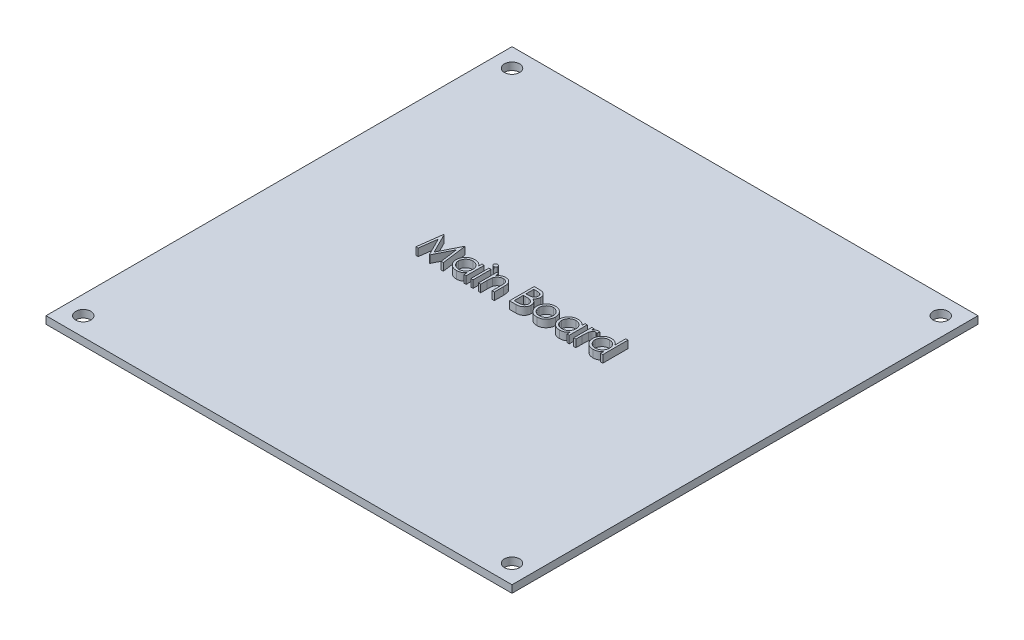
from build123d import *

# Parameters (mm, degrees)
SKETCH18_W            = 100
SKETCH18_H            = 100
BOSS_EXTRUDE6_DEPTH   = 1.6
F_4_CLEARANCE_HOLE3_D = 3.2639
SKETCH24_W            = 0.474893163
SKETCH24_H            = 3.866987179
BOSS_EXTRUDE7_DEPTH   = 1.6


with BuildPart() as part:
    # Sketch18 → Boss-Extrude6 (new body)
    with BuildSketch(Plane(origin=(0, 0, 0), x_dir=(1, 0, 0), z_dir=(0, 1, 0))):
        Rectangle(SKETCH18_W, SKETCH18_H)
    extrude(amount=BOSS_EXTRUDE6_DEPTH)

    # #4 Clearance Hole3 (through all)
    with Locations(Plane(origin=(0, 1.6, 0), x_dir=(1, 0, 0), z_dir=(0, 1, 0))):
        with Locations((-46, 46), (46, 46), (46, -46), (-46, -46)):
            Hole(F_4_CLEARANCE_HOLE3_D / 2)

    # Sketch24 → Boss-Extrude7 (add)
    # profile 1 of 10: a face of its own
    with BuildSketch(Plane(origin=(0, 1.6, 0), x_dir=(1, 0, 0), z_dir=(0, 1, 0))):
        Polygon((-21.523729355, 0.904850997), (-20.825169994, 6.196517663), (-20.757328113, 6.196517663), (-18.57260756, 1.854637321), (-16.393187154, 6.196517663), (-16.324285245, 6.196517663), (-15.621485765, 0.904850997), (-16.098498987, 0.904850997), (-16.60519303, 4.712476531), (-18.515365974, 0.904850997), (-18.622428941, 0.904850997), (-20.54002209, 4.720956766), (-21.045656105, 0.904850997), align=None)
    # profile 2 of 10: a face of its own
    with BuildSketch(Plane(origin=(0, 1.6, 0), x_dir=(1, 0, 0), z_dir=(0, 1, 0))):
        with BuildLine():
            Line((-10.736870381, 4.771838176), (-10.736870381, 0.904850997))
            Line((-10.736870381, 0.904850997), (-11.211763543, 0.904850997))
            Line((-11.211763543, 0.904850997), (-11.211763543, 1.573729536))
            add(Edge.make_bspline(
                [(-11.211763543, 1.573729536), (-11.265313381, 1.513193483), (-11.369816564, 1.395056615), (-11.54435254, 1.240718092), (-11.729361571, 1.113146106), (-11.923945711, 1.010109924), (-12.127929246, 0.93271241), (-12.340859997, 0.877700003), (-12.562824823, 0.842330752), (-12.714396835, 0.838798909), (-12.79120732, 0.837009116)],
                knots=[0, 0, 0, 0, 1.074387032, 2.096679803, 3.090159297, 4.057316773, 5.018401886, 5.985159533, 6.978961417, 8, 8, 8, 8], degree=3))
            add(Edge.make_bspline(
                [(-12.79120732, 0.837009116), (-12.859496964, 0.838863274), (-12.994167167, 0.842519756), (-13.192270653, 0.870886572), (-13.382910125, 0.916441203), (-13.566265729, 0.979791357), (-13.741150996, 1.063824266), (-13.909063285, 1.164428296), (-14.069132713, 1.284232884), (-14.218919444, 1.421193356), (-14.35685354, 1.569957205), (-14.477898559, 1.728624877), (-14.578822859, 1.896510265), (-14.663217505, 2.071487772), (-14.728223882, 2.254904376), (-14.773541163, 2.446125809), (-14.801874933, 2.644925975), (-14.805529904, 2.780301206), (-14.807383201, 2.84894488)],
                knots=[0, 0, 0, 0, 1.033919861, 2.038935746, 3.024066025, 3.998881131, 4.97069526, 5.957263378, 6.95902576, 7.993208707, 9.027059324, 10.027763471, 11.009749337, 11.988697705, 12.965288445, 13.950418724, 14.960734635, 16, 16, 16, 16], degree=3))
            add(Edge.make_bspline(
                [(-14.807383201, 2.84894488), (-14.805488828, 2.916169765), (-14.801743754, 3.049069737), (-14.773844243, 3.244526816), (-14.726928313, 3.432786567), (-14.661088115, 3.613242898), (-14.576660397, 3.786114164), (-14.473959599, 3.951522631), (-14.352978303, 4.109923982), (-14.21350145, 4.257593575), (-14.062409595, 4.393998551), (-13.900773776, 4.51254556), (-13.732614767, 4.614926986), (-13.555324263, 4.696045933), (-13.371526378, 4.761676365), (-13.179584859, 4.807083352), (-12.980298306, 4.833840016), (-12.844997205, 4.837714672), (-12.776366909, 4.839680057)],
                knots=[0, 0, 0, 0, 1.020392517, 2.01726096, 2.990465484, 3.961182959, 4.928053699, 5.906110375, 6.912531644, 7.948652711, 8.985773172, 9.998621852, 10.987621588, 11.969261332, 12.953316658, 13.946091881, 14.958173133, 16, 16, 16, 16], degree=3))
            add(Edge.make_bspline(
                [(-12.776366909, 4.839680057), (-12.697445693, 4.837506313), (-12.542684914, 4.833243705), (-12.316310424, 4.797770296), (-12.102157463, 4.737840708), (-11.898572907, 4.656322586), (-11.706287822, 4.547996532), (-11.527122596, 4.411350638), (-11.359202163, 4.247246701), (-11.261865294, 4.121198529), (-11.211763543, 4.056318344)],
                knots=[0, 0, 0, 0, 1.038897134, 2.037228247, 3.008116434, 3.962042015, 4.918381754, 5.904844433, 6.921570401, 8, 8, 8, 8], degree=3))
            Line((-11.211763543, 4.056318344), (-11.211763543, 4.771838176))
            Line((-11.211763543, 4.771838176), (-10.736870381, 4.771838176))
        make_face()
        with BuildLine():
            add(Edge.make_bspline(
                [(-12.770006732, 4.364786894), (-12.839424838, 4.362316989), (-12.976445138, 4.35744179), (-13.177594999, 4.319381863), (-13.370080756, 4.256056346), (-13.552939701, 4.169451566), (-13.723283314, 4.060550977), (-13.875522555, 3.928831742), (-14.010902591, 3.777887685), (-14.124761515, 3.608399971), (-14.217578099, 3.426702142), (-14.282842541, 3.236769956), (-14.325885331, 3.042029097), (-14.330282737, 2.909945037), (-14.332490039, 2.843644733)],
                knots=[0, 0, 0, 0, 1.031046209, 2.035121221, 3.029706178, 4.034933723, 5.034054252, 6.02443088, 7.017295772, 8.038157696, 9.050218397, 10.03989886, 11.016116709, 12, 12, 12, 12], degree=3))
            add(Edge.make_bspline(
                [(-14.332490039, 2.843644733), (-14.329670498, 2.777740643), (-14.324042467, 2.646190783), (-14.283597965, 2.451184435), (-14.215743871, 2.26120749), (-14.123151704, 2.077872417), (-14.007208831, 1.907655979), (-13.872817654, 1.753834604), (-13.718678538, 1.621558679), (-13.547942903, 1.510830442), (-13.365595138, 1.421382345), (-13.173834313, 1.359143819), (-12.976265193, 1.318960746), (-12.841928927, 1.314267072), (-12.77424685, 1.311902279)],
                knots=[0, 0, 0, 0, 0.979072187, 1.954306742, 2.945804271, 3.96968567, 4.997920485, 5.998718438, 6.996577872, 8.005894225, 9.015743152, 10.005417472, 10.995077863, 12, 12, 12, 12], degree=3))
            add(Edge.make_bspline(
                [(-12.77424685, 1.311902279), (-12.705536066, 1.314411986), (-12.568877131, 1.319403545), (-12.367130514, 1.357626411), (-12.171346463, 1.420776856), (-11.984191963, 1.508314821), (-11.809844955, 1.616805109), (-11.653366021, 1.74381583), (-11.521050212, 1.891533739), (-11.408878052, 2.05387671), (-11.320922362, 2.231846038), (-11.256853797, 2.421339398), (-11.218974677, 2.622363386), (-11.214200491, 2.75974099), (-11.211763543, 2.829864351)],
                knots=[0, 0, 0, 0, 1.01762866, 2.023962475, 3.030623092, 4.058876274, 5.077231937, 6.066672613, 7.034107872, 8.005628644, 8.981990164, 9.965428785, 10.961468474, 12, 12, 12, 12], degree=3))
            add(Edge.make_bspline(
                [(-11.211763543, 2.829864351), (-11.213214452, 2.883291786), (-11.2160703, 2.988453884), (-11.237887947, 3.142860964), (-11.27259361, 3.29062505), (-11.321497938, 3.431901496), (-11.385740713, 3.565909198), (-11.463222455, 3.693610359), (-11.555305694, 3.81434081), (-11.660508104, 3.926438072), (-11.775662636, 4.028682842), (-11.897513906, 4.119947825), (-12.027505583, 4.194921327), (-12.163451579, 4.256971821), (-12.305587763, 4.306349345), (-12.455070724, 4.339290263), (-12.610311574, 4.361908843), (-12.716214538, 4.363817443), (-12.770006732, 4.364786894)],
                knots=[0, 0, 0, 0, 1.050140795, 2.067009409, 3.05949893, 4.030605086, 5.00011959, 5.97591094, 6.962425594, 7.979863591, 8.993523472, 9.986985069, 10.967611495, 11.937549037, 12.921786183, 13.919465291, 14.943216303, 16, 16, 16, 16], degree=3))
        make_face(mode=Mode.SUBTRACT)
    # profile 3 of 10: a face of its own
    with BuildSketch(Plane(origin=(0, 1.6, 0), x_dir=(1, 0, 0), z_dir=(0, 1, 0))):
        with BuildLine():
            add(Edge.make_bspline(
                [(-9.483915653, 6.400043304), (-9.45444664, 6.398676312), (-9.396740652, 6.395999479), (-9.313293688, 6.373076769), (-9.237309872, 6.334221292), (-9.169912586, 6.282091299), (-9.112079376, 6.220784402), (-9.071589493, 6.149330319), (-9.045565989, 6.07213452), (-9.042423411, 6.018287897), (-9.040823372, 5.990871964)],
                knots=[0, 0, 0, 0, 1.055194115, 2.066272739, 3.074728998, 4.095836921, 5.109056067, 6.073838105, 7.019297344, 8, 8, 8, 8], degree=3))
            add(Edge.make_bspline(
                [(-9.040823372, 5.990871964), (-9.042459495, 5.964167714), (-9.045693916, 5.911376573), (-9.071569392, 5.835519062), (-9.112424442, 5.765057824), (-9.169875501, 5.703869964), (-9.237319699, 5.651768789), (-9.313291078, 5.612905672), (-9.396741339, 5.589984988), (-9.454446872, 5.587307875), (-9.483915653, 5.58594074)],
                knots=[0, 0, 0, 0, 0.96129708, 1.900370562, 2.859976407, 3.87933698, 4.906634145, 5.921202961, 6.938410037, 8, 8, 8, 8], degree=3))
            add(Edge.make_bspline(
                [(-9.483915653, 5.58594074), (-9.51304745, 5.587255674), (-9.569748687, 5.589815022), (-9.651946175, 5.613355406), (-9.727282105, 5.651782088), (-9.794810836, 5.70352882), (-9.851099343, 5.765433605), (-9.89206943, 5.835476061), (-9.917885146, 5.911387521), (-9.92112762, 5.964171392), (-9.922767817, 5.990871964)],
                knots=[0, 0, 0, 0, 1.054934014, 2.053291228, 3.073705704, 4.106921865, 5.123545215, 6.088680038, 7.033164197, 8, 8, 8, 8], degree=3))
            add(Edge.make_bspline(
                [(-9.922767817, 5.990871964), (-9.921163555, 6.018284081), (-9.918012683, 6.07212321), (-9.892050079, 6.149374034), (-9.851440608, 6.22040559), (-9.794773565, 6.282432238), (-9.727292024, 6.334208074), (-9.651943612, 6.372627058), (-9.569749364, 6.39616944), (-9.51304768, 6.398728512), (-9.483915653, 6.400043304)],
                knots=[0, 0, 0, 0, 0.98631895, 1.937192651, 2.907499808, 3.917963147, 4.944918757, 5.95915025, 6.951458133, 8, 8, 8, 8], degree=3))
        make_face()
    # profile 4 of 10: a face of its own
    with BuildSketch(Plane(origin=(0, 1.6, 0), x_dir=(1, 0, 0), z_dir=(0, 1, 0))):
        with Locations((-9.481795594, 2.838344586)):
            Rectangle(SKETCH24_W, SKETCH24_H)
    # profile 5 of 10: a face of its own
    with BuildSketch(Plane(origin=(0, 1.6, 0), x_dir=(1, 0, 0), z_dir=(0, 1, 0))):
        with BuildLine():
            Line((-8.091037047, 4.771838176), (-7.616143885, 4.771838176))
            Line((-7.616143885, 4.771838176), (-7.616143885, 4.074338844))
            add(Edge.make_bspline(
                [(-7.616143885, 4.074338844), (-7.565438175, 4.137601056), (-7.467041975, 4.260363585), (-7.303175185, 4.42171493), (-7.129995717, 4.554679735), (-6.948564117, 4.660669994), (-6.758634089, 4.74056906), (-6.561363372, 4.798272313), (-6.355570899, 4.832871994), (-6.215622287, 4.837392938), (-6.144823105, 4.839680057)],
                knots=[0, 0, 0, 0, 1.12780773, 2.188550248, 3.19190651, 4.159438251, 5.104880172, 6.052711206, 7.014878035, 8, 8, 8, 8], degree=3))
            add(Edge.make_bspline(
                [(-6.144823105, 4.839680057), (-6.073263694, 4.837041487), (-5.933204665, 4.831877171), (-5.729281882, 4.791030507), (-5.538822108, 4.721263276), (-5.362504447, 4.625692645), (-5.203562112, 4.506847144), (-5.06397573, 4.36839026), (-4.948521772, 4.209132134), (-4.871116235, 4.061384029), (-4.820126268, 3.930318828), (-4.788024996, 3.818064813), (-4.760763869, 3.693002846), (-4.737130155, 3.555510848), (-4.721138569, 3.404625489), (-4.708525819, 3.240965288), (-4.699486602, 3.064583258), (-4.699127968, 2.942592761), (-4.69894303, 2.879685732)],
                knots=[0, 0, 0, 0, 1.235846778, 2.418850247, 3.575807741, 4.728682307, 5.871620074, 6.994088408, 8.11269785, 9.256955736, 9.865816715, 10.540099792, 11.271859618, 12.076849838, 12.949306005, 13.892391288, 14.913166135, 16, 16, 16, 16], degree=3))
            Line((-4.69894303, 2.879685732), (-4.69894303, 0.904850997))
            Line((-4.69894303, 0.904850997), (-5.173836193, 0.904850997))
            Line((-5.173836193, 0.904850997), (-5.173836193, 2.723861413))
            add(Edge.make_bspline(
                [(-5.173836193, 2.723861413), (-5.174128305, 2.776509634), (-5.174687066, 2.877216719), (-5.176449412, 3.021405599), (-5.180697572, 3.152165069), (-5.186667046, 3.269182517), (-5.195404389, 3.37234558), (-5.204510034, 3.461864367), (-5.215645178, 3.537625223), (-5.225567677, 3.583231955), (-5.23001775, 3.603685799)],
                knots=[0, 0, 0, 0, 1.430800155, 2.736877192, 3.918605307, 4.986035426, 5.920637409, 6.731861385, 7.431261377, 8, 8, 8, 8], degree=3))
            add(Edge.make_bspline(
                [(-5.23001775, 3.603685799), (-5.246082542, 3.663725329), (-5.277002295, 3.779282847), (-5.353404865, 3.936028595), (-5.449885829, 4.069375855), (-5.567659958, 4.178500184), (-5.705589632, 4.26342514), (-5.863292098, 4.322350047), (-6.039245519, 4.359204645), (-6.16300155, 4.362874237), (-6.227505397, 4.364786894)],
                knots=[0, 0, 0, 0, 1.084156227, 2.086665306, 3.027808233, 3.945421172, 4.874247719, 5.839848303, 6.874090471, 8, 8, 8, 8], degree=3))
            add(Edge.make_bspline(
                [(-6.227505397, 4.364786894), (-6.265707728, 4.36406722), (-6.341309154, 4.362643005), (-6.45341685, 4.348353542), (-6.56215935, 4.32498183), (-6.668627999, 4.293430437), (-6.770693354, 4.250095816), (-6.871634604, 4.200914506), (-6.967650783, 4.139609471), (-7.060789252, 4.071285556), (-7.147440759, 3.995570564), (-7.228068128, 3.915674697), (-7.299941087, 3.830591344), (-7.365056822, 3.741691423), (-7.421266816, 3.647754001), (-7.470332794, 3.549685348), (-7.511964142, 3.447356384), (-7.53265107, 3.376334566), (-7.543001858, 3.340798513)],
                knots=[0, 0, 0, 0, 1.023777757, 2.026029729, 3.023749952, 4.003683103, 4.997618607, 5.993177895, 7.010360494, 8.046726602, 9.087585522, 10.09234134, 11.086953743, 12.070360549, 13.043493632, 14.017870808, 15.008233677, 16, 16, 16, 16], degree=3))
            add(Edge.make_bspline(
                [(-7.543001858, 3.340798513), (-7.548958231, 3.314710289), (-7.561924945, 3.257917591), (-7.57592999, 3.1647171), (-7.588641444, 3.056903209), (-7.599280655, 2.934601729), (-7.605790035, 2.797384466), (-7.612887515, 2.645837425), (-7.615471453, 2.479356318), (-7.615913464, 2.36345114), (-7.616143885, 2.303029749)],
                knots=[0, 0, 0, 0, 0.615963638, 1.340920617, 2.168419149, 3.115676021, 4.16674242, 5.331190069, 6.6087489, 8, 8, 8, 8], degree=3))
            Line((-7.616143885, 2.303029749), (-7.616143885, 0.904850997))
            Line((-7.616143885, 0.904850997), (-8.091037047, 0.904850997))
            Line((-8.091037047, 0.904850997), (-8.091037047, 4.771838176))
        make_face()
    # profile 6 of 10: a face of its own
    with BuildSketch(Plane(origin=(0, 1.6, 0), x_dir=(1, 0, 0), z_dir=(0, 1, 0))):
        with BuildLine():
            Line((-1.442532774, 6.196517663), (-0.410064158, 6.196517663))
            add(Edge.make_bspline(
                [(-0.410064158, 6.196517663), (-0.359523482, 6.196251945), (-0.261563075, 6.195736918), (-0.119112252, 6.187749327), (0.014311545, 6.176858064), (0.13874701, 6.159576853), (0.254136644, 6.138724999), (0.36082819, 6.113473444), (0.458482379, 6.083195111), (0.575069493, 6.035046567), (0.707997159, 5.963498443), (0.851928062, 5.857773113), (0.975003519, 5.728456175), (1.081118546, 5.582583588), (1.165484525, 5.42211641), (1.226519058, 5.250879303), (1.265160131, 5.071080955), (1.269134073, 4.947644246), (1.27114244, 4.88526132)],
                knots=[0, 0, 0, 0, 1.001505555, 1.941167018, 2.826882275, 3.653841531, 4.429895133, 5.150066043, 5.825578002, 6.45369114, 7.647487171, 8.808567382, 9.977351308, 11.170798116, 12.373658725, 13.556498008, 14.765093433, 16, 16, 16, 16], degree=3))
            add(Edge.make_bspline(
                [(1.27114244, 4.88526132), (1.269489598, 4.826822337), (1.266241607, 4.711984224), (1.235182911, 4.544020511), (1.186559043, 4.38413474), (1.118968964, 4.232910419), (1.03112428, 4.093764361), (0.92701706, 3.96557409), (0.801412846, 3.853767135), (0.707306995, 3.791260604), (0.659505487, 3.759510118)],
                knots=[0, 0, 0, 0, 1.044552857, 2.05264487, 3.044412934, 4.028983338, 5.005914585, 5.980388656, 6.974128949, 8, 8, 8, 8], degree=3))
            add(Edge.make_bspline(
                [(0.659505487, 3.759510118), (0.719619467, 3.736430893), (0.834632402, 3.69227462), (0.992907683, 3.614206716), (1.129273698, 3.529294954), (1.244778907, 3.436567037), (1.343563219, 3.336616811), (1.429821833, 3.227978722), (1.503423434, 3.1092356), (1.566489402, 2.981625493), (1.615700021, 2.846451428), (1.652554067, 2.704981326), (1.67367152, 2.557722474), (1.676676644, 2.457505294), (1.678193722, 2.406912629)],
                knots=[0, 0, 0, 0, 1.27268992, 2.434971085, 3.483601985, 4.442670788, 5.356604649, 6.2567628, 7.179492994, 8.113709626, 9.066344395, 10.018646069, 10.999752585, 12, 12, 12, 12], degree=3))
            add(Edge.make_bspline(
                [(1.678193722, 2.406912629), (1.676716824, 2.355255572), (1.673810985, 2.253618866), (1.652372218, 2.104310508), (1.616072735, 1.961624576), (1.566072311, 1.824638169), (1.500815002, 1.693616299), (1.421397723, 1.568410531), (1.326704764, 1.450278865), (1.220776379, 1.337908625), (1.100939563, 1.236871375), (0.971647886, 1.146889295), (0.831273093, 1.07288751), (0.682120674, 1.010724002), (0.522517481, 0.963239309), (0.353180206, 0.930018869), (0.174254892, 0.907635064), (0.051473483, 0.905794766), (-0.01149311, 0.904850997)],
                knots=[0, 0, 0, 0, 0.978564426, 1.925352924, 2.850884081, 3.763762016, 4.682927383, 5.618979971, 6.567305752, 7.547517671, 8.540179244, 9.531824382, 10.526200242, 11.540722885, 12.589160233, 13.674978461, 14.80764778, 16, 16, 16, 16], degree=3))
            Line((-0.01149311, 0.904850997), (-1.442532774, 0.904850997))
            Line((-1.442532774, 0.904850997), (-1.442532774, 6.196517663))
        make_face()
        with BuildLine():
            Line((-0.967639612, 5.653782621), (-0.967639612, 3.957735612))
            Line((-0.967639612, 3.957735612), (-0.648570768, 3.957735612))
            add(Edge.make_bspline(
                [(-0.648570768, 3.957735612), (-0.601930327, 3.958340258), (-0.511811491, 3.959508556), (-0.381304029, 3.962855183), (-0.260162632, 3.972226034), (-0.148596408, 3.981594192), (-0.046781047, 3.996826009), (0.045057887, 4.014956957), (0.128361718, 4.034132302), (0.224427459, 4.066743312), (0.333394893, 4.114939321), (0.449559229, 4.189736025), (0.551967296, 4.278824035), (0.638443997, 4.381619894), (0.709218482, 4.494810437), (0.758376123, 4.616589649), (0.791709517, 4.743922468), (0.794720523, 4.83133816), (0.796249277, 4.875721055)],
                knots=[0, 0, 0, 0, 1.156816544, 2.235205308, 3.236616184, 4.169592532, 5.011045266, 5.787822928, 6.49130361, 7.128639758, 8.301311294, 9.436451833, 10.541879658, 11.654887649, 12.756523258, 13.837046038, 14.901820046, 16, 16, 16, 16], degree=3))
            add(Edge.make_bspline(
                [(0.796249277, 4.875721055), (0.795453743, 4.905090972), (0.793893216, 4.96270327), (0.781112627, 5.046688603), (0.759390223, 5.125676181), (0.731489089, 5.200748467), (0.692499048, 5.26955805), (0.646592383, 5.334484072), (0.591127113, 5.39331549), (0.527994033, 5.448302707), (0.455409568, 5.497053363), (0.373417019, 5.539750707), (0.280907079, 5.574132595), (0.179438834, 5.604243921), (0.067450404, 5.625392889), (-0.053765885, 5.643011701), (-0.185202901, 5.651981442), (-0.276136567, 5.653168836), (-0.323141748, 5.653782621)],
                knots=[0, 0, 0, 0, 0.91205012, 1.789085906, 2.630437955, 3.453916878, 4.269457761, 5.079663411, 5.91843418, 6.774407191, 7.675494373, 8.627863946, 9.638891023, 10.736472738, 11.911756761, 13.175263542, 14.539845004, 16, 16, 16, 16], degree=3))
            Line((-0.323141748, 5.653782621), (-0.967639612, 5.653782621))
        make_face(mode=Mode.SUBTRACT)
        with BuildLine():
            Line((-0.967639612, 3.415000569), (-0.967639612, 1.447586039))
            Line((-0.967639612, 1.447586039), (-0.291340867, 1.447586039))
            add(Edge.make_bspline(
                [(-0.291340867, 1.447586039), (-0.2429313, 1.448166229), (-0.149628243, 1.449284468), (-0.014915669, 1.452935044), (0.109942119, 1.461238842), (0.224375372, 1.474310543), (0.329619747, 1.488489865), (0.424412703, 1.507556921), (0.50952265, 1.529402373), (0.608211187, 1.563169515), (0.719341491, 1.615627274), (0.839100762, 1.694721402), (0.945578496, 1.788948308), (1.035998353, 1.898003381), (1.110101323, 2.016584077), (1.164008976, 2.142291928), (1.197257057, 2.273049809), (1.201282003, 2.362201862), (1.203300559, 2.406912629)],
                knots=[0, 0, 0, 0, 1.160039823, 2.235823828, 3.228722157, 4.157150951, 4.99529583, 5.772374946, 6.472645482, 7.099169577, 8.269452708, 9.405989375, 10.527446681, 11.663510218, 12.788923519, 13.866172445, 14.929861265, 16, 16, 16, 16], degree=3))
            add(Edge.make_bspline(
                [(1.203300559, 2.406912629), (1.202883116, 2.434872798), (1.202054962, 2.490342137), (1.189565699, 2.571857721), (1.171401872, 2.650818268), (1.147919824, 2.727438185), (1.113721344, 2.800332218), (1.073797162, 2.87094204), (1.026986472, 2.939360991), (0.954045888, 3.02586047), (0.84795253, 3.125520715), (0.697205382, 3.223095272), (0.525797264, 3.3017866), (0.401477126, 3.335198903), (0.337256556, 3.352458836)],
                knots=[0, 0, 0, 0, 0.723448775, 1.435228256, 2.130040452, 2.821711965, 3.505591119, 4.210454504, 4.921174351, 5.648778258, 7.137944449, 8.670945889, 10.280296675, 12, 12, 12, 12], degree=3))
            add(Edge.make_bspline(
                [(0.337256556, 3.352458836), (0.311510185, 3.357682594), (0.255686741, 3.369008778), (0.164658614, 3.380964473), (0.060736526, 3.391615932), (-0.05631949, 3.399494706), (-0.186657536, 3.407638647), (-0.330555973, 3.410805817), (-0.487427151, 3.414584461), (-0.596272761, 3.414858318), (-0.652810886, 3.415000569)],
                knots=[0, 0, 0, 0, 0.634451884, 1.375622551, 2.216452059, 3.157844607, 4.20941857, 5.370758133, 6.634282058, 8, 8, 8, 8], degree=3))
            Line((-0.652810886, 3.415000569), (-0.967639612, 3.415000569))
        make_face(mode=Mode.SUBTRACT)
    # profile 7 of 10: a face of its own
    with BuildSketch(Plane(origin=(0, 1.6, 0), x_dir=(1, 0, 0), z_dir=(0, 1, 0))):
        with BuildLine():
            add(Edge.make_bspline(
                [(4.495751815, 4.839680057), (4.568310049, 4.838135054), (4.710579013, 4.835105683), (4.918931412, 4.802728294), (5.117815129, 4.753217398), (5.307991872, 4.684771108), (5.487026033, 4.593025778), (5.657525414, 4.483549826), (5.819022559, 4.353854714), (5.915819281, 4.253527635), (5.964952536, 4.202602399)],
                knots=[0, 0, 0, 0, 1.054011418, 2.066658804, 3.057071809, 4.030435133, 4.997543892, 5.974964718, 6.972108034, 8, 8, 8, 8], degree=3))
            add(Edge.make_bspline(
                [(5.964952536, 4.202602399), (6.007258585, 4.15389792), (6.091051946, 4.057431529), (6.198496545, 3.901016495), (6.291057713, 3.739030867), (6.365236237, 3.569323599), (6.423724309, 3.39337618), (6.465249826, 3.210583853), (6.489949716, 3.021350305), (6.493280392, 2.892832597), (6.494967226, 2.827744293)],
                knots=[0, 0, 0, 0, 1.025258237, 2.030674902, 3.01204498, 3.988269485, 4.97094183, 5.956517959, 6.965070386, 8, 8, 8, 8], degree=3))
            add(Edge.make_bspline(
                [(6.494967226, 2.827744293), (6.493483537, 2.762278729), (6.4905517, 2.632915723), (6.462817899, 2.442386444), (6.419681614, 2.257639509), (6.357947764, 2.079448389), (6.278787289, 1.9072684), (6.182190654, 1.741851581), (6.067479995, 1.58287157), (5.937450143, 1.431678315), (5.793740758, 1.292331776), (5.637838963, 1.170883083), (5.472808459, 1.066831492), (5.296454818, 0.983016911), (5.110388499, 0.916932007), (4.91420817, 0.870516506), (4.708218599, 0.842453008), (4.5675703, 0.838849273), (4.495751815, 0.837009116)],
                knots=[0, 0, 0, 0, 0.998656419, 1.973391657, 2.932242238, 3.890759089, 4.846373663, 5.82037756, 6.809684879, 7.83454468, 8.860553229, 9.859544525, 10.845671541, 11.83227036, 12.833544569, 13.85385346, 14.904124723, 16, 16, 16, 16], degree=3))
            add(Edge.make_bspline(
                [(4.495751815, 0.837009116), (4.423581465, 0.838855449), (4.282232189, 0.842471584), (4.075515526, 0.870407476), (3.878983602, 0.916910616), (3.692673697, 0.983234087), (3.515561845, 1.066834171), (3.349575118, 1.170568511), (3.193546674, 1.292367794), (3.049806888, 1.431668556), (2.919785187, 1.582874085), (2.805072424, 1.741850929), (2.708476336, 1.90726857), (2.629315718, 2.079448344), (2.567581906, 2.257639522), (2.524445611, 2.44238644), (2.496711813, 2.632915724), (2.493779975, 2.76227873), (2.492296286, 2.827744293)],
                knots=[0, 0, 0, 0, 1.099876186, 2.154163076, 3.173186993, 4.173200201, 5.163417411, 6.152872554, 7.150605724, 8.17532212, 9.198891216, 10.186952605, 11.159729845, 12.11414092, 13.071450619, 14.029093627, 15.002601286, 16, 16, 16, 16], degree=3))
            add(Edge.make_bspline(
                [(2.492296286, 2.827744293), (2.493994624, 2.892478832), (2.497357042, 3.020642095), (2.522032097, 3.209519913), (2.563395629, 3.392002871), (2.621953812, 3.56727115), (2.696816065, 3.736234726), (2.788076584, 3.898620601), (2.896617183, 4.054328347), (2.980077276, 4.150670063), (3.022310976, 4.199422311)],
                knots=[0, 0, 0, 0, 1.031353054, 2.041901799, 3.029428768, 4.008703097, 4.981709435, 5.96992636, 6.972712378, 8, 8, 8, 8], degree=3))
            add(Edge.make_bspline(
                [(3.022310976, 4.199422311), (3.071370155, 4.250789183), (3.167853664, 4.351811176), (3.330154716, 4.481128207), (3.50023466, 4.592882271), (3.681247346, 4.682804644), (3.871267858, 4.753620022), (4.07117076, 4.80285598), (4.28023017, 4.834989028), (4.423195312, 4.838100797), (4.495751815, 4.839680057)],
                knots=[0, 0, 0, 0, 1.027980169, 2.021703884, 2.998553061, 3.971491411, 4.943284454, 5.930300938, 6.949603206, 8, 8, 8, 8], degree=3))
        make_face()
        with BuildLine():
            add(Edge.make_bspline(
                [(4.493631756, 4.364786894), (4.44232132, 4.363328523), (4.341025018, 4.360449429), (4.191921598, 4.338551145), (4.048381128, 4.303856704), (3.91013128, 4.254562476), (3.777638269, 4.190912951), (3.650775244, 4.112734835), (3.529169055, 4.021063579), (3.415198555, 3.916042635), (3.310601487, 3.801320822), (3.219164547, 3.679085803), (3.141414683, 3.551320256), (3.076644443, 3.417891317), (3.028403814, 3.277446835), (2.993368411, 3.131577309), (2.971490785, 2.979985548), (2.96863876, 2.87693258), (2.967189448, 2.824564204)],
                knots=[0, 0, 0, 0, 1.021534396, 2.016698045, 2.994645724, 3.958388632, 4.93408049, 5.916473867, 6.921342795, 7.962252576, 8.998418191, 10.008913653, 10.997312074, 11.973003931, 12.956656626, 13.948281152, 14.957379055, 16, 16, 16, 16], degree=3))
            add(Edge.make_bspline(
                [(2.967189448, 2.824564204), (2.969618813, 2.756903402), (2.974440646, 2.62260936), (3.013652254, 2.424835401), (3.079248177, 2.2349676), (3.167826564, 2.054119017), (3.278809776, 1.886793073), (3.409569984, 1.737611185), (3.558703816, 1.608818352), (3.724433525, 1.501955645), (3.903373982, 1.417047442), (4.09274961, 1.356875182), (4.290265898, 1.317759647), (4.42524986, 1.313871822), (4.493631756, 1.311902279)],
                knots=[0, 0, 0, 0, 1.016792936, 2.018143844, 3.017858371, 4.030088057, 5.03801393, 6.028138512, 7.003788237, 7.991172063, 8.984598303, 9.972568034, 10.972917682, 12, 12, 12, 12], degree=3))
            add(Edge.make_bspline(
                [(4.493631756, 1.311902279), (4.562009719, 1.313883298), (4.696985917, 1.317793774), (4.894227768, 1.35667818), (5.083085797, 1.417311096), (5.261840395, 1.501860151), (5.427494664, 1.609224159), (5.577701074, 1.73688392), (5.707344807, 1.887188195), (5.818218234, 2.054340649), (5.908247237, 2.234687229), (5.973536126, 2.424870443), (6.012842, 2.622600435), (6.01765111, 2.756900412), (6.020074064, 2.824564204)],
                knots=[0, 0, 0, 0, 1.02726834, 2.027799167, 3.010890988, 4.004497153, 4.992059811, 5.971914811, 6.958719428, 7.966827853, 8.981595046, 9.981490638, 10.983022906, 12, 12, 12, 12], degree=3))
            add(Edge.make_bspline(
                [(6.020074064, 2.824564204), (6.018625251, 2.876932893), (6.015774208, 2.979986477), (5.99388944, 3.131573758), (5.95888047, 3.277459862), (5.910542429, 3.417843248), (5.846053623, 3.551665725), (5.766804423, 3.67871067), (5.675740849, 3.801744257), (5.569881631, 3.915671785), (5.456030095, 4.021104519), (5.334374621, 4.112770382), (5.207699713, 4.190569365), (5.075591618, 4.255106896), (4.937324045, 4.303408232), (4.793984695, 4.338751472), (4.645517447, 4.360356889), (4.544584131, 4.363300781), (4.493631756, 4.364786894)],
                knots=[0, 0, 0, 0, 1.042956736, 2.052379634, 3.044323526, 4.02829302, 5.004299113, 5.996692471, 7.007513377, 8.048758398, 9.090003419, 10.095195979, 11.07790575, 12.047570684, 13.018257071, 13.989683339, 14.985167495, 16, 16, 16, 16], degree=3))
        make_face(mode=Mode.SUBTRACT)
    # profile 8 of 10: a face of its own
    with BuildSketch(Plane(origin=(0, 1.6, 0), x_dir=(1, 0, 0), z_dir=(0, 1, 0))):
        with BuildLine():
            Line((11.379582611, 4.771838176), (11.379582611, 0.904850997))
            Line((11.379582611, 0.904850997), (10.904689448, 0.904850997))
            Line((10.904689448, 0.904850997), (10.904689448, 1.573729536))
            add(Edge.make_bspline(
                [(10.904689448, 1.573729536), (10.85113961, 1.513193483), (10.746636427, 1.395056615), (10.572100451, 1.240718092), (10.387091421, 1.113146106), (10.19250728, 1.010109924), (9.988523746, 0.93271241), (9.775592995, 0.877700003), (9.553628169, 0.842330752), (9.402056156, 0.838798909), (9.325245672, 0.837009116)],
                knots=[0, 0, 0, 0, 1.074387032, 2.096679803, 3.090159297, 4.057316773, 5.018401886, 5.985159533, 6.978961417, 8, 8, 8, 8], degree=3))
            add(Edge.make_bspline(
                [(9.325245672, 0.837009116), (9.256956027, 0.838863274), (9.122285824, 0.842519756), (8.924182339, 0.870886572), (8.733542866, 0.916441203), (8.550187262, 0.979791357), (8.375301995, 1.063824266), (8.207389706, 1.164428296), (8.047320279, 1.284232884), (7.897533547, 1.421193356), (7.759599451, 1.569957205), (7.638554432, 1.728624877), (7.537630133, 1.896510265), (7.453235487, 2.071487772), (7.388229109, 2.254904376), (7.342911829, 2.446125809), (7.314578058, 2.644925975), (7.310923088, 2.780301206), (7.30906979, 2.84894488)],
                knots=[0, 0, 0, 0, 1.033919861, 2.038935746, 3.024066025, 3.998881131, 4.97069526, 5.957263378, 6.95902576, 7.993208707, 9.027059324, 10.027763471, 11.009749337, 11.988697705, 12.965288445, 13.950418724, 14.960734635, 16, 16, 16, 16], degree=3))
            add(Edge.make_bspline(
                [(7.30906979, 2.84894488), (7.310964164, 2.916169765), (7.314709238, 3.049069737), (7.342608749, 3.244526816), (7.389524678, 3.432786567), (7.455364877, 3.613242898), (7.539792594, 3.786114164), (7.642493392, 3.951522631), (7.763474688, 4.109923982), (7.902951542, 4.257593575), (8.054043396, 4.393998551), (8.215679216, 4.51254556), (8.383838224, 4.614926986), (8.561128728, 4.696045933), (8.744926613, 4.761676365), (8.936868132, 4.807083352), (9.136154686, 4.833840016), (9.271455787, 4.837714672), (9.340086083, 4.839680057)],
                knots=[0, 0, 0, 0, 1.020392517, 2.01726096, 2.990465484, 3.961182959, 4.928053699, 5.906110375, 6.912531644, 7.948652711, 8.985773172, 9.998621852, 10.987621588, 11.969261332, 12.953316658, 13.946091881, 14.958173133, 16, 16, 16, 16], degree=3))
            add(Edge.make_bspline(
                [(9.340086083, 4.839680057), (9.419007298, 4.837506313), (9.573768077, 4.833243705), (9.800142567, 4.797770296), (10.014295528, 4.737840708), (10.217880084, 4.656322586), (10.410165169, 4.547996532), (10.589330395, 4.411350638), (10.757250828, 4.247246701), (10.854587698, 4.121198529), (10.904689448, 4.056318344)],
                knots=[0, 0, 0, 0, 1.038897134, 2.037228247, 3.008116434, 3.962042015, 4.918381754, 5.904844433, 6.921570401, 8, 8, 8, 8], degree=3))
            Line((10.904689448, 4.056318344), (10.904689448, 4.771838176))
            Line((10.904689448, 4.771838176), (11.379582611, 4.771838176))
        make_face()
        with BuildLine():
            add(Edge.make_bspline(
                [(9.346446259, 4.364786894), (9.277028153, 4.362316989), (9.140007853, 4.35744179), (8.938857993, 4.319381863), (8.746372236, 4.256056346), (8.56351329, 4.169451566), (8.393169677, 4.060550977), (8.240930437, 3.928831742), (8.1055504, 3.777887685), (7.991691477, 3.608399971), (7.898874892, 3.426702142), (7.833610451, 3.236769956), (7.79056766, 3.042029097), (7.786170254, 2.909945037), (7.783962953, 2.843644733)],
                knots=[0, 0, 0, 0, 1.031046209, 2.035121221, 3.029706178, 4.034933723, 5.034054252, 6.02443088, 7.017295772, 8.038157696, 9.050218397, 10.03989886, 11.016116709, 12, 12, 12, 12], degree=3))
            add(Edge.make_bspline(
                [(7.783962953, 2.843644733), (7.786782494, 2.777740643), (7.792410524, 2.646190783), (7.832855026, 2.451184435), (7.900709121, 2.26120749), (7.993301287, 2.077872417), (8.10924416, 1.907655979), (8.243635337, 1.753834604), (8.397774453, 1.621558679), (8.568510089, 1.510830442), (8.750857853, 1.421382345), (8.942618678, 1.359143819), (9.140187798, 1.318960746), (9.274524065, 1.314267072), (9.342206142, 1.311902279)],
                knots=[0, 0, 0, 0, 0.979072187, 1.954306742, 2.945804271, 3.96968567, 4.997920485, 5.998718438, 6.996577872, 8.005894225, 9.015743152, 10.005417472, 10.995077863, 12, 12, 12, 12], degree=3))
            add(Edge.make_bspline(
                [(9.342206142, 1.311902279), (9.410916926, 1.314411986), (9.54757586, 1.319403545), (9.749322478, 1.357626411), (9.945106529, 1.420776856), (10.132261029, 1.508314821), (10.306608037, 1.616805109), (10.463086971, 1.74381583), (10.59540278, 1.891533739), (10.70757494, 2.05387671), (10.795530629, 2.231846038), (10.859599195, 2.421339398), (10.897478314, 2.622363386), (10.902252501, 2.75974099), (10.904689448, 2.829864351)],
                knots=[0, 0, 0, 0, 1.01762866, 2.023962475, 3.030623092, 4.058876274, 5.077231937, 6.066672613, 7.034107872, 8.005628644, 8.981990164, 9.965428785, 10.961468474, 12, 12, 12, 12], degree=3))
            add(Edge.make_bspline(
                [(10.904689448, 2.829864351), (10.903238539, 2.883291786), (10.900382691, 2.988453884), (10.878565044, 3.142860964), (10.843859382, 3.29062505), (10.794955053, 3.431901496), (10.730712278, 3.565909198), (10.653230537, 3.693610359), (10.561147297, 3.81434081), (10.455944888, 3.926438072), (10.340790355, 4.028682842), (10.218939086, 4.119947825), (10.088947409, 4.194921327), (9.953001412, 4.256971821), (9.810865228, 4.306349345), (9.661382267, 4.339290263), (9.506141418, 4.361908843), (9.400238453, 4.363817443), (9.346446259, 4.364786894)],
                knots=[0, 0, 0, 0, 1.050140795, 2.067009409, 3.05949893, 4.030605086, 5.00011959, 5.97591094, 6.962425594, 7.979863591, 8.993523472, 9.986985069, 10.967611495, 11.937549037, 12.921786183, 13.919465291, 14.943216303, 16, 16, 16, 16], degree=3))
        make_face(mode=Mode.SUBTRACT)
    # profile 9 of 10: a face of its own
    with BuildSketch(Plane(origin=(0, 1.6, 0), x_dir=(1, 0, 0), z_dir=(0, 1, 0))):
        with BuildLine():
            Line((12.329368935, 4.771838176), (12.804262098, 4.771838176))
            Line((12.804262098, 4.771838176), (12.804262098, 4.202602399))
            add(Edge.make_bspline(
                [(12.804262098, 4.202602399), (12.839321293, 4.255603473), (12.90637173, 4.356967614), (13.017818659, 4.491027153), (13.131972505, 4.602023711), (13.249379753, 4.69047546), (13.370903785, 4.756716723), (13.493877509, 4.805238336), (13.62023566, 4.833930229), (13.705147141, 4.83776088), (13.747688246, 4.839680057)],
                knots=[0, 0, 0, 0, 1.2804753, 2.448899062, 3.506932113, 4.484331642, 5.4025378, 6.288909075, 7.142734305, 8, 8, 8, 8], degree=3))
            add(Edge.make_bspline(
                [(13.747688246, 4.839680057), (13.780687573, 4.837880094), (13.848585833, 4.834176553), (13.951369034, 4.808155425), (14.057268063, 4.766611272), (14.125519053, 4.727543317), (14.161099705, 4.707176384)],
                knots=[0, 0, 0, 0, 0.901110191, 1.854092781, 2.881294221, 4, 4, 4, 4], degree=3))
            Line((14.161099705, 4.707176384), (13.900332477, 4.295884984))
            add(Edge.make_bspline(
                [(13.900332477, 4.295884984), (13.877489076, 4.306075625), (13.834127928, 4.325419411), (13.770696619, 4.348312688), (13.712214122, 4.361792704), (13.674955409, 4.36383486), (13.657585749, 4.364786894)],
                knots=[0, 0, 0, 0, 1.180555205, 2.24091978, 3.179933427, 4, 4, 4, 4], degree=3))
            add(Edge.make_bspline(
                [(13.657585749, 4.364786894), (13.61947708, 4.362246838), (13.541746443, 4.357065859), (13.427621069, 4.316336947), (13.31687827, 4.250530929), (13.228928257, 4.177549605), (13.16082866, 4.107173769), (13.1122357, 4.045717255), (13.067660595, 3.976806705), (13.025069905, 3.901620159), (12.986264912, 3.818873845), (12.950047734, 3.729394462), (12.917301596, 3.633078375), (12.898629203, 3.565976231), (12.889064448, 3.531603801)],
                knots=[0, 0, 0, 0, 1.125678352, 2.296057538, 3.5422874, 4.923748041, 5.663163013, 6.437101912, 7.23742474, 8.08941207, 8.991984279, 9.93940061, 10.944477711, 12, 12, 12, 12], degree=3))
            add(Edge.make_bspline(
                [(12.889064448, 3.531603801), (12.88190952, 3.500946646), (12.866061898, 3.433043376), (12.850653264, 3.319123583), (12.835429111, 3.18452829), (12.8246997, 3.028882846), (12.814754327, 2.852575936), (12.809145036, 2.655338971), (12.804453383, 2.4369695), (12.804327794, 2.284305894), (12.804262098, 2.204447017)],
                knots=[0, 0, 0, 0, 0.566838948, 1.255505196, 2.06880316, 3.007127437, 4.065329342, 5.249902469, 6.561414163, 8, 8, 8, 8], degree=3))
            Line((12.804262098, 2.204447017), (12.804262098, 0.904850997))
            Line((12.804262098, 0.904850997), (12.329368935, 0.904850997))
            Line((12.329368935, 0.904850997), (12.329368935, 4.771838176))
        make_face()
    # profile 10 of 10: a face of its own
    with BuildSketch(Plane(origin=(0, 1.6, 0), x_dir=(1, 0, 0), z_dir=(0, 1, 0))):
        with BuildLine():
            Line((18.570821927, 6.332201424), (18.570821927, 0.904850997))
            Line((18.570821927, 0.904850997), (18.095928765, 0.904850997))
            Line((18.095928765, 0.904850997), (18.095928765, 1.573729536))
            add(Edge.make_bspline(
                [(18.095928765, 1.573729536), (18.042378926, 1.513193483), (17.937875744, 1.395056615), (17.763339768, 1.240718092), (17.578330737, 1.113146106), (17.383746597, 1.010109924), (17.179763062, 0.93271241), (16.966832311, 0.877700003), (16.744867485, 0.842330752), (16.593295473, 0.838798909), (16.516484988, 0.837009116)],
                knots=[0, 0, 0, 0, 1.074387032, 2.096679803, 3.090159297, 4.057316773, 5.018401886, 5.985159533, 6.978961417, 8, 8, 8, 8], degree=3))
            add(Edge.make_bspline(
                [(16.516484988, 0.837009116), (16.448195343, 0.838863274), (16.313525141, 0.842519756), (16.115421655, 0.870886572), (15.924782183, 0.916441203), (15.741426579, 0.979791357), (15.566541311, 1.063824266), (15.398629022, 1.164428296), (15.238559595, 1.284232884), (15.088772863, 1.421193356), (14.950838768, 1.569957205), (14.829793748, 1.728624877), (14.728869449, 1.896510265), (14.644474803, 2.071487772), (14.579468425, 2.254904376), (14.534151145, 2.446125809), (14.505817374, 2.644925975), (14.502162404, 2.780301206), (14.500309106, 2.84894488)],
                knots=[0, 0, 0, 0, 1.033919861, 2.038935746, 3.024066025, 3.998881131, 4.97069526, 5.957263378, 6.95902576, 7.993208707, 9.027059324, 10.027763471, 11.009749337, 11.988697705, 12.965288445, 13.950418724, 14.960734635, 16, 16, 16, 16], degree=3))
            add(Edge.make_bspline(
                [(14.500309106, 2.84894488), (14.50220348, 2.916169765), (14.505948554, 3.049069737), (14.533848065, 3.244526816), (14.580763995, 3.432786567), (14.646604193, 3.613242898), (14.73103191, 3.786114164), (14.833732709, 3.951522631), (14.954714004, 4.109923982), (15.094190858, 4.257593575), (15.245282713, 4.393998551), (15.406918532, 4.51254556), (15.575077541, 4.614926986), (15.752368045, 4.696045933), (15.936165929, 4.761676365), (16.128107449, 4.807083352), (16.327394002, 4.833840016), (16.462695103, 4.837714672), (16.531325399, 4.839680057)],
                knots=[0, 0, 0, 0, 1.020392517, 2.01726096, 2.990465484, 3.961182959, 4.928053699, 5.906110375, 6.912531644, 7.948652711, 8.985773172, 9.998621852, 10.987621588, 11.969261332, 12.953316658, 13.946091881, 14.958173133, 16, 16, 16, 16], degree=3))
            add(Edge.make_bspline(
                [(16.531325399, 4.839680057), (16.610272239, 4.837310757), (16.765236113, 4.832660084), (16.991868402, 4.793794505), (17.206237765, 4.728536345), (17.409578354, 4.639195955), (17.600677915, 4.523080534), (17.780937241, 4.382849178), (17.94722155, 4.214533136), (18.045603949, 4.0881204), (18.095928765, 4.023457434)],
                knots=[0, 0, 0, 0, 1.031072012, 2.023879775, 2.993683497, 3.952812103, 4.918022106, 5.908088563, 6.929940113, 8, 8, 8, 8], degree=3))
            Line((18.095928765, 4.023457434), (18.095928765, 6.332201424))
            Line((18.095928765, 6.332201424), (18.570821927, 6.332201424))
        make_face()
        with BuildLine():
            add(Edge.make_bspline(
                [(16.537685575, 4.364786894), (16.468267469, 4.362316989), (16.331247169, 4.35744179), (16.130097309, 4.319381863), (15.937611552, 4.256056346), (15.754752606, 4.169451566), (15.584408993, 4.060550977), (15.432169753, 3.928831742), (15.296789716, 3.777887685), (15.182930793, 3.608399971), (15.090114208, 3.426702142), (15.024849767, 3.236769956), (14.981806976, 3.042029097), (14.97740957, 2.909945037), (14.975202269, 2.843644733)],
                knots=[0, 0, 0, 0, 1.031046209, 2.035121221, 3.029706178, 4.034933723, 5.034054252, 6.02443088, 7.017295772, 8.038157696, 9.050218397, 10.03989886, 11.016116709, 12, 12, 12, 12], degree=3))
            add(Edge.make_bspline(
                [(14.975202269, 2.843644733), (14.97802181, 2.777740643), (14.98364984, 2.646190783), (15.024094343, 2.451184435), (15.091948437, 2.26120749), (15.184540603, 2.077872417), (15.300483476, 1.907655979), (15.434874653, 1.753834604), (15.589013769, 1.621558679), (15.759749405, 1.510830442), (15.94209717, 1.421382345), (16.133857995, 1.359143819), (16.331427114, 1.318960746), (16.465763381, 1.314267072), (16.533445458, 1.311902279)],
                knots=[0, 0, 0, 0, 0.979072187, 1.954306742, 2.945804271, 3.96968567, 4.997920485, 5.998718438, 6.996577872, 8.005894225, 9.015743152, 10.005417472, 10.995077863, 12, 12, 12, 12], degree=3))
            add(Edge.make_bspline(
                [(16.533445458, 1.311902279), (16.602156242, 1.314411986), (16.738815176, 1.319403545), (16.940561794, 1.357626411), (17.136345845, 1.420776856), (17.323500345, 1.508314821), (17.497847353, 1.616805109), (17.654326287, 1.74381583), (17.786642096, 1.891533739), (17.898814256, 2.05387671), (17.986769945, 2.231846038), (18.050838511, 2.421339398), (18.088717631, 2.622363386), (18.093491817, 2.75974099), (18.095928765, 2.829864351)],
                knots=[0, 0, 0, 0, 1.01762866, 2.023962475, 3.030623092, 4.058876274, 5.077231937, 6.066672613, 7.034107872, 8.005628644, 8.981990164, 9.965428785, 10.961468474, 12, 12, 12, 12], degree=3))
            add(Edge.make_bspline(
                [(18.095928765, 2.829864351), (18.094477855, 2.883291786), (18.091622007, 2.988453884), (18.069804361, 3.142860964), (18.035098698, 3.29062505), (17.98619437, 3.431901496), (17.921951594, 3.565909198), (17.844469853, 3.693610359), (17.752386614, 3.81434081), (17.647184204, 3.926438072), (17.532029672, 4.028682842), (17.410178402, 4.119947825), (17.280186725, 4.194921327), (17.144240729, 4.256971821), (17.002104544, 4.306349345), (16.852621583, 4.339290263), (16.697380734, 4.361908843), (16.591477769, 4.363817443), (16.537685575, 4.364786894)],
                knots=[0, 0, 0, 0, 1.050140795, 2.067009409, 3.05949893, 4.030605086, 5.00011959, 5.97591094, 6.962425594, 7.979863591, 8.993523472, 9.986985069, 10.967611495, 11.937549037, 12.921786183, 13.919465291, 14.943216303, 16, 16, 16, 16], degree=3))
        make_face(mode=Mode.SUBTRACT)
    extrude(amount=BOSS_EXTRUDE7_DEPTH)


solid = part.part
